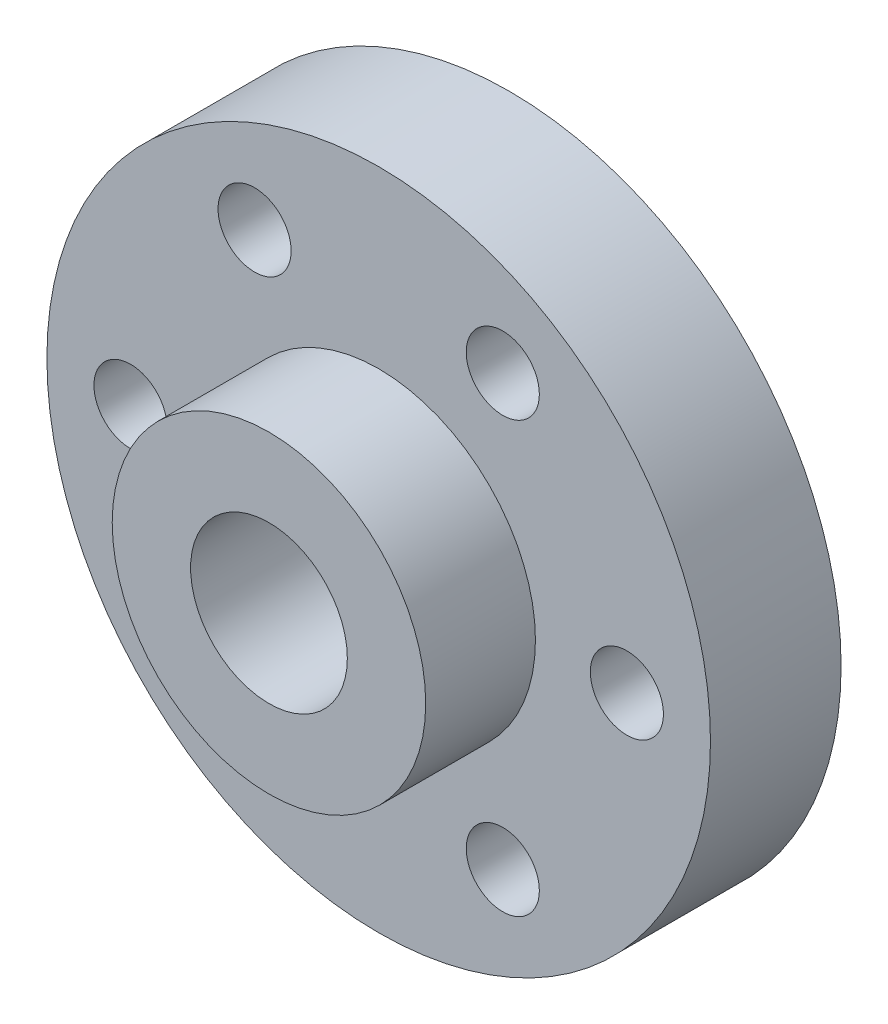
from build123d import *

# Parameters (mm, degrees)
SKETCH_1_R           = 12.7
SKETCH_1_R_2         = 1.39954
SKETCH_1_R_3         = 6
EXTRUDE_1_DEPTH      = 5
EXTRUDE_2_DEPTH      = 4.2
EXTRUDE_2_DEPTH_BACK = 5
SKETCH_1_3_R         = 6
SKETCH_1_3_R_2       = 3


with BuildPart() as part:
    # 草图1 → 凸台-拉伸1 (new body)
    with BuildSketch(Plane.XY):
        Circle(SKETCH_1_R)
        with Locations((-4.75, -8.227241336)):
            Circle(SKETCH_1_R_2, mode=Mode.SUBTRACT)
        with Locations((4.75, -8.227241336)):
            Circle(SKETCH_1_R_2, mode=Mode.SUBTRACT)
        with Locations((-9.5, 0)):
            Circle(SKETCH_1_R_2, mode=Mode.SUBTRACT)
        with Locations((-4.75, 8.227241336)):
            Circle(SKETCH_1_R_2, mode=Mode.SUBTRACT)
        Circle(SKETCH_1_R_3, mode=Mode.SUBTRACT)
        with Locations((9.5, 0)):
            Circle(SKETCH_1_R_2, mode=Mode.SUBTRACT)
        with Locations((4.75, 8.227241336)):
            Circle(SKETCH_1_R_2, mode=Mode.SUBTRACT)
    extrude(amount=-EXTRUDE_1_DEPTH)

    # 草图1<3> → 凸台-拉伸2 (add, two sides: drawn at the far end of the back side and taken through both)
    with BuildSketch(Plane.XY.offset(-EXTRUDE_2_DEPTH_BACK)):
        Circle(SKETCH_1_3_R)
        Circle(SKETCH_1_3_R_2, mode=Mode.SUBTRACT)
    extrude(amount=EXTRUDE_2_DEPTH + EXTRUDE_2_DEPTH_BACK)


solid = part.part
